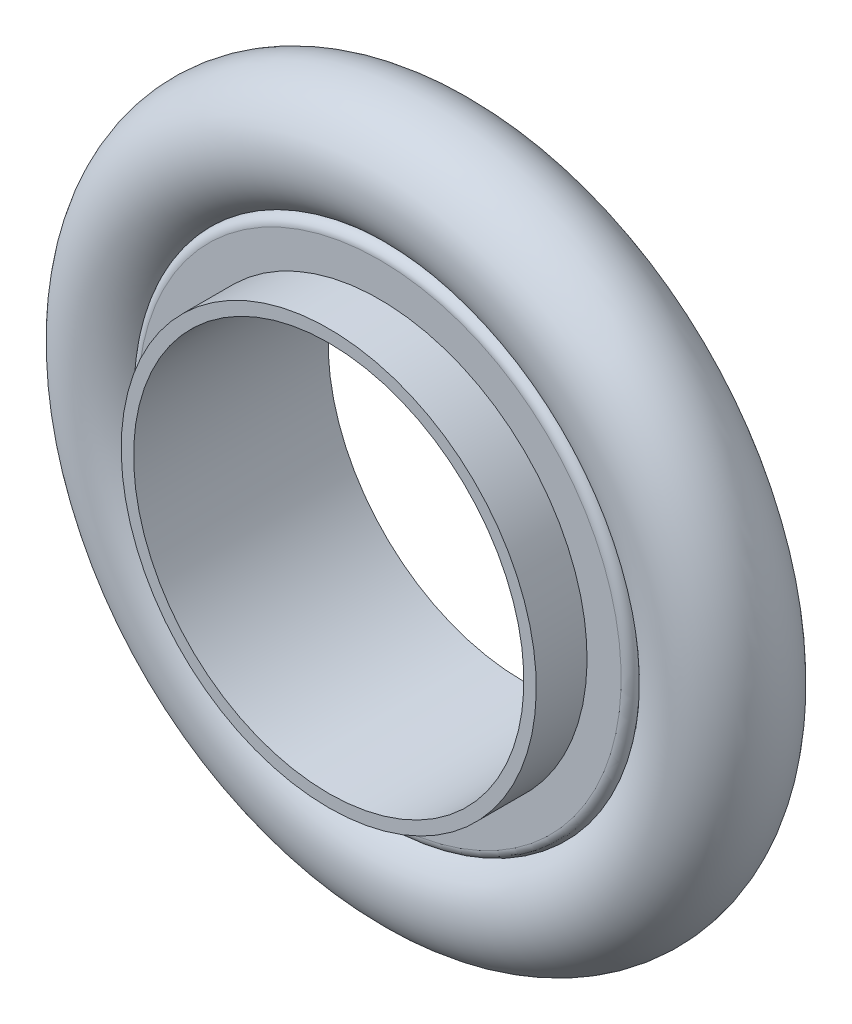
from build123d import *

# Parameters (mm, degrees)
SKETCH3_R = 2.415722718


with BuildPart() as part:
    # Sketch2 → Revolve1 (revolve)
    with BuildSketch(Plane(origin=(0, 0, 0), x_dir=(0, 0, -1), z_dir=(1, 0, 0)), mode=Mode.PRIVATE) as revolve1_sk:
        with BuildLine():
            Line((-1.905, 8.509), (-1.905, 9.906))
            ThreePointArc((-1.905, 9.906), (-1.793407684, 10.175407684), (-1.524, 10.287))
            ThreePointArc((-1.524, 10.287), (0, 9.745614565), (1.524, 10.287))
            ThreePointArc((1.524, 10.287), (1.793407684, 10.175407684), (1.905, 9.906))
            Line((1.905, 9.906), (1.905, 8.509))
            Line((1.905, 8.509), (3.9878, 8.509))
            Line((3.9878, 8.509), (3.9878, 8.001))
            Line((3.9878, 8.001), (-3.9878, 8.001))
            Line((-3.9878, 8.001), (-3.9878, 8.509))
            Line((-3.9878, 8.509), (-1.905, 8.509))
        make_face()
    revolve(revolve1_sk.sketch.rotate(Axis((0, 0, 3.9878), (0, 0, -1)), 180), axis=Axis((0, 0, 3.9878), (0, 0, -1)))


with BuildPart() as body_2:
    # Sketch3 → Revolve2 (revolve)
    with BuildSketch(Plane(origin=(0, 0, 0), x_dir=(0, 0, -1), z_dir=(1, 0, 0))):
        with Locations((0, 12.161337282)):
            Circle(SKETCH3_R)
    revolve(axis=Axis((0, 0, 3.9878), (0, 0, -1)))


solid = Compound([part.part, body_2.part])
